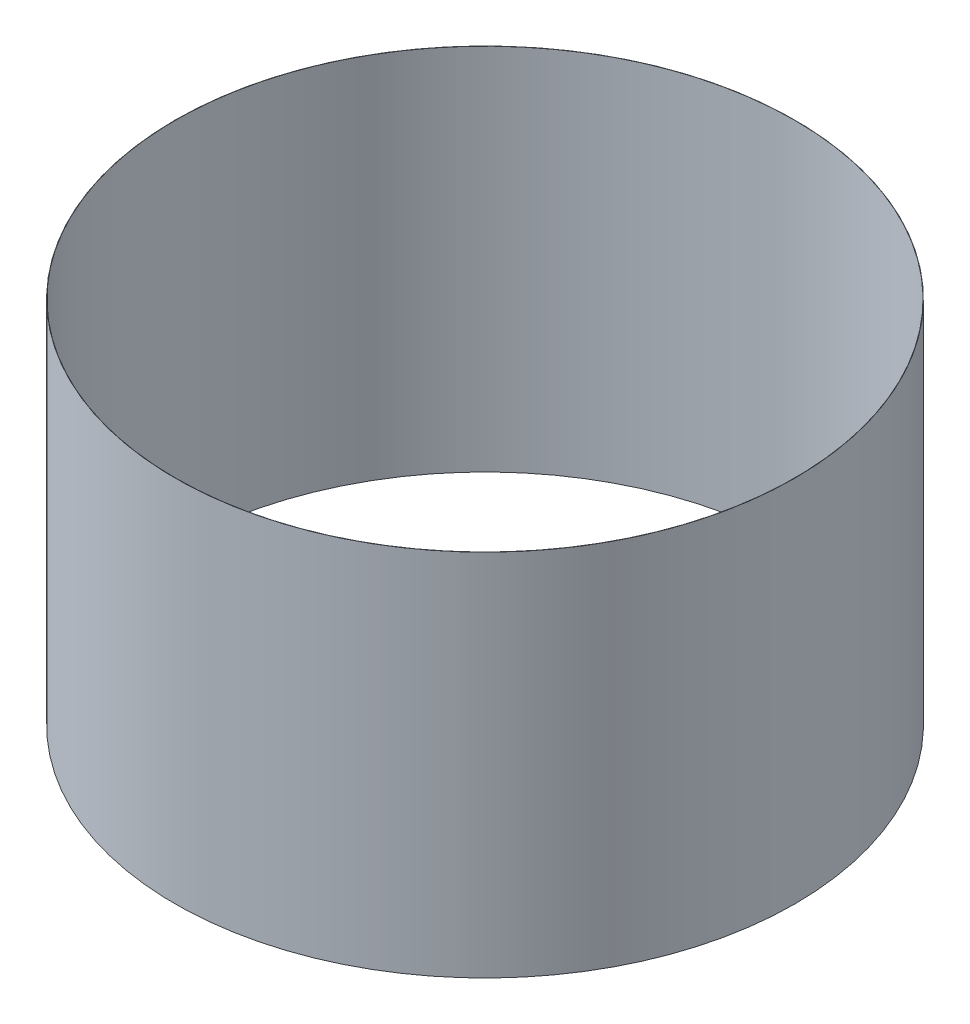
from build123d import *

# Parameters (mm, degrees)
SKETCH1_R           = 126.1
SKETCH1_R_2         = 126
EXTRUDE_THIN1_DEPTH = 150


with BuildPart() as part:
    # Sketch1 → Extrude-Thin1 (new body)
    with BuildSketch(Plane(origin=(0, 0, 0), x_dir=(1, 0, 0), z_dir=(0, 1, 0))):
        Circle(SKETCH1_R)
        Circle(SKETCH1_R_2, mode=Mode.SUBTRACT)
    extrude(amount=EXTRUDE_THIN1_DEPTH)


solid = part.part
